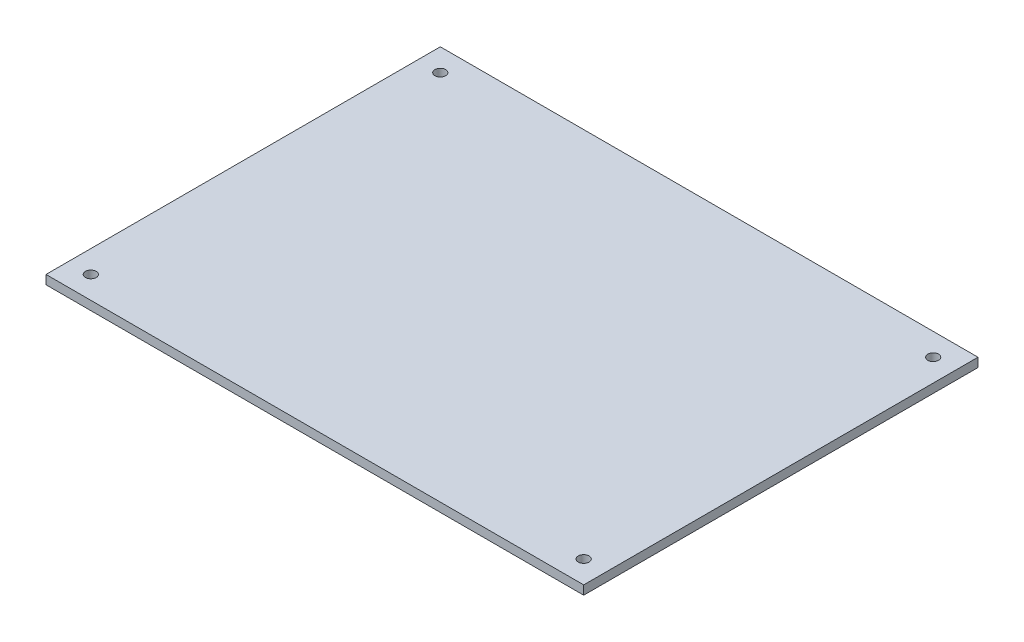
from build123d import *

# Parameters (mm, degrees)
SKETCH1_W                    = 300
SKETCH1_H                    = 220
BOSS_EXTRUDE1_DEPTH          = 5
SKETCH2_R                    = 12.5
CUT_EXTRUDE1_DEPTH           = 1
F_6_0_6_DIAMETER_HOLE1_D     = 6
F_6_0_6_DIAMETER_HOLE1_DEPTH = 10
F_6_0_6_DIAMETER_HOLE1_TIP   = 1.802581857


with BuildPart() as part:
    # Sketch1 → Boss-Extrude1 (new body)
    with BuildSketch(Plane(origin=(0, 0, 0), x_dir=(1, 0, 0), z_dir=(0, 1, 0))):
        Rectangle(SKETCH1_W, SKETCH1_H)
    extrude(amount=BOSS_EXTRUDE1_DEPTH)

    # Sketch2 → Cut-Extrude1 (cut)
    with BuildSketch(Plane.XZ):
        with Locations(Location((-55, 0, 0), (0, 0, 270))):
            Circle(SKETCH2_R)
    extrude(amount=-CUT_EXTRUDE1_DEPTH, mode=Mode.SUBTRACT)

    # Ø6.0 (6) Diameter Hole1
    with Locations(Plane(origin=(0, 0, 0), x_dir=(-1, 0, 0), z_dir=(0, -1, 0))):
        with Locations((137.5, -97.5), (137.5, 97.5), (-137.5, 97.5), (-137.5, -97.5)):
            Hole(F_6_0_6_DIAMETER_HOLE1_D / 2, depth=F_6_0_6_DIAMETER_HOLE1_DEPTH)
            with Locations((0, 0, -(F_6_0_6_DIAMETER_HOLE1_DEPTH + F_6_0_6_DIAMETER_HOLE1_TIP / 2))):  # 118° drill point
                Cone(0, F_6_0_6_DIAMETER_HOLE1_D / 2, F_6_0_6_DIAMETER_HOLE1_TIP, mode=Mode.SUBTRACT)


solid = part.part
